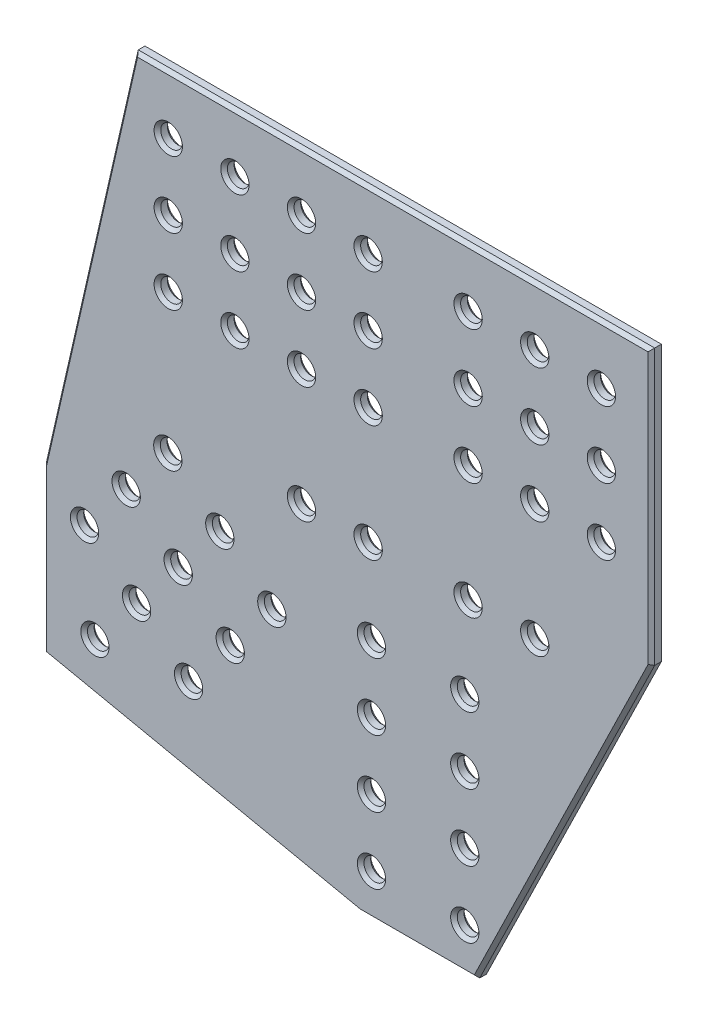
from build123d import *

# Parameters (mm, degrees)
SKETCH_1_R         = 13
EXTRUDE_1498_DEPTH = 16
CHAMFER_2_SIZE     = 4


with BuildPart() as part:
    # 草图1 → Extrude 1498 (new body)
    with BuildSketch(Plane.XY):
        Polygon((730, -330), (520, -760), (380, -760), (0, -680), (0, -482.786642105), (110, 0), (730, 0), align=None)
        with Locations((510, -70)):
            Circle(SKETCH_1_R, mode=Mode.SUBTRACT)
        with Locations((590, -70)):
            Circle(SKETCH_1_R, mode=Mode.SUBTRACT)
        with Locations((670, -70)):
            Circle(SKETCH_1_R, mode=Mode.SUBTRACT)
        with Locations((510, -150)):
            Circle(SKETCH_1_R, mode=Mode.SUBTRACT)
        with Locations((590, -150)):
            Circle(SKETCH_1_R, mode=Mode.SUBTRACT)
        with Locations((670, -150)):
            Circle(SKETCH_1_R, mode=Mode.SUBTRACT)
        with Locations((510, -230)):
            Circle(SKETCH_1_R, mode=Mode.SUBTRACT)
        with Locations((590, -230)):
            Circle(SKETCH_1_R, mode=Mode.SUBTRACT)
        with Locations((670, -230)):
            Circle(SKETCH_1_R, mode=Mode.SUBTRACT)
        with Locations(Location((230, -230, 0), (0, 0, 180))):
            Circle(SKETCH_1_R, mode=Mode.SUBTRACT)
        with Locations(Location((310, -230, 0), (0, 0, 180))):
            Circle(SKETCH_1_R, mode=Mode.SUBTRACT)
        with Locations(Location((390, -230, 0), (0, 0, 180))):
            Circle(SKETCH_1_R, mode=Mode.SUBTRACT)
        with Locations(Location((230, -150, 0), (0, 0, 180))):
            Circle(SKETCH_1_R, mode=Mode.SUBTRACT)
        with Locations(Location((310, -150, 0), (0, 0, 180))):
            Circle(SKETCH_1_R, mode=Mode.SUBTRACT)
        with Locations(Location((390, -150, 0), (0, 0, 180))):
            Circle(SKETCH_1_R, mode=Mode.SUBTRACT)
        with Locations(Location((230, -70, 0), (0, 0, 180))):
            Circle(SKETCH_1_R, mode=Mode.SUBTRACT)
        with Locations(Location((310, -70, 0), (0, 0, 180))):
            Circle(SKETCH_1_R, mode=Mode.SUBTRACT)
        with Locations(Location((390, -70, 0), (0, 0, 180))):
            Circle(SKETCH_1_R, mode=Mode.SUBTRACT)
        with Locations((150, -70)):
            Circle(SKETCH_1_R, mode=Mode.SUBTRACT)
        with Locations((150, -150)):
            Circle(SKETCH_1_R, mode=Mode.SUBTRACT)
        with Locations((150, -230)):
            Circle(SKETCH_1_R, mode=Mode.SUBTRACT)
        with Locations((590, -370)):
            Circle(SKETCH_1_R, mode=Mode.SUBTRACT)
        with Locations((510, -370)):
            Circle(SKETCH_1_R, mode=Mode.SUBTRACT)
        with Locations(Location((390, -370, 0), (0, 0, 180))):
            Circle(SKETCH_1_R, mode=Mode.SUBTRACT)
        with Locations(Location((310, -370, 0), (0, 0, 180))):
            Circle(SKETCH_1_R, mode=Mode.SUBTRACT)
        with Locations((506, -470)):
            Circle(SKETCH_1_R, mode=Mode.SUBTRACT)
        with Locations((506, -550)):
            Circle(SKETCH_1_R, mode=Mode.SUBTRACT)
        with Locations((506, -630)):
            Circle(SKETCH_1_R, mode=Mode.SUBTRACT)
        with Locations((506, -710)):
            Circle(SKETCH_1_R, mode=Mode.SUBTRACT)
        with Locations(Location((394, -710, 0), (0, 0, 180))):
            Circle(SKETCH_1_R, mode=Mode.SUBTRACT)
        with Locations(Location((394, -630, 0), (0, 0, 180))):
            Circle(SKETCH_1_R, mode=Mode.SUBTRACT)
        with Locations(Location((394, -550, 0), (0, 0, 180))):
            Circle(SKETCH_1_R, mode=Mode.SUBTRACT)
        with Locations(Location((394, -470, 0), (0, 0, 180))):
            Circle(SKETCH_1_R, mode=Mode.SUBTRACT)
        with Locations((149.479377198, -397.484050539)):
            Circle(SKETCH_1_R, mode=Mode.SUBTRACT)
        with Locations((99.493096694, -459.945012437)):
            Circle(SKETCH_1_R, mode=Mode.SUBTRACT)
        with Locations((49.506816189, -522.405974336)):
            Circle(SKETCH_1_R, mode=Mode.SUBTRACT)
        with Locations((61.981497584, -634.85321674)):
            Circle(SKETCH_1_R, mode=Mode.SUBTRACT)
        with Locations((111.967778088, -572.392254841)):
            Circle(SKETCH_1_R, mode=Mode.SUBTRACT)
        with Locations((161.954058593, -509.931292942)):
            Circle(SKETCH_1_R, mode=Mode.SUBTRACT)
        with Locations((211.940339097, -447.470331043)):
            Circle(SKETCH_1_R, mode=Mode.SUBTRACT)
        with Locations(Location((174.428739987, -622.378535345, 0), (0, 0, 180))):
            Circle(SKETCH_1_R, mode=Mode.SUBTRACT)
        with Locations(Location((224.415020492, -559.917573446, 0), (0, 0, 180))):
            Circle(SKETCH_1_R, mode=Mode.SUBTRACT)
        with Locations(Location((274.401300996, -497.456611548, 0), (0, 0, 180))):
            Circle(SKETCH_1_R, mode=Mode.SUBTRACT)
    extrude(amount=EXTRUDE_1498_DEPTH)

    # 倒角2
    chamfer_2_edges = [part.edges().sort_by_distance(p)[0] for p in [
        (55, -241.393321053, 16),
        (497, -370, 0),
        (497, -370, 16),
        (403, -370, 0),
        (403, -370, 16),
        (323, -370, 0),
        (323, -370, 16),
        (493, -470, 0),
        (493, -470, 16),
        (493, -550, 0),
        (493, -550, 16),
        (493, -630, 0),
        (493, -630, 16),
        (493, -710, 0),
        (493, -710, 16),
        (407, -710, 0),
        (407, -710, 16),
        (0, -581.393321053, 16),
        (407, -630, 0),
        (407, -630, 16),
        (407, -550, 0),
        (407, -550, 16),
        (136.479377198, -397.484050539, 0),
        (136.479377198, -397.484050539, 16),
        (86.493096694, -459.945012437, 0),
        (86.493096694, -459.945012437, 16),
        (36.506816189, -522.405974336, 0),
        (36.506816189, -522.405974336, 16),
        (48.981497584, -634.85321674, 0),
        (48.981497584, -634.85321674, 16),
        (98.967778088, -572.392254841, 0),
        (98.967778088, -572.392254841, 16),
        (148.954058593, -509.931292942, 0),
        (148.954058593, -509.931292942, 16),
        (190, -720, 16),
        (198.940339097, -447.470331043, 0),
        (198.940339097, -447.470331043, 16),
        (187.428739987, -622.378535345, 0),
        (187.428739987, -622.378535345, 16),
        (237.415020492, -559.917573446, 0),
        (237.415020492, -559.917573446, 16),
        (287.401300996, -497.456611548, 0),
        (287.401300996, -497.456611548, 16),
        (407, -470, 0),
        (407, -470, 16),
        (497, -70, 0),
        (497, -70, 16),
        (450, -760, 16),
        (625, -545, 16),
        (577, -70, 0),
        (577, -70, 16),
        (657, -70, 0),
        (657, -70, 16),
        (497, -150, 0),
        (497, -150, 16),
        (577, -150, 0),
        (577, -150, 16),
        (657, -150, 0),
        (657, -150, 16),
        (730, -165, 16),
        (497, -230, 0),
        (497, -230, 16),
        (577, -230, 0),
        (577, -230, 16),
        (657, -230, 0),
        (657, -230, 16),
        (243, -230, 0),
        (243, -230, 16),
        (323, -230, 0),
        (323, -230, 16),
        (403, -230, 0),
        (403, -230, 16),
        (243, -150, 0),
        (243, -150, 16),
        (323, -150, 0),
        (323, -150, 16),
        (625, -545, 0),
        (420, 0, 16),
        (403, -150, 0),
        (403, -150, 16),
        (450, -760, 0),
        (243, -70, 0),
        (243, -70, 16),
        (190, -720, 0),
        (323, -70, 0),
        (323, -70, 16),
        (0, -581.393321053, 0),
        (403, -70, 0),
        (403, -70, 16),
        (55, -241.393321053, 0),
        (137, -70, 0),
        (137, -70, 16),
        (420, 0, 0),
        (137, -150, 0),
        (137, -150, 16),
        (730, -165, 0),
        (137, -230, 0),
        (137, -230, 16),
        (577, -370, 0),
        (577, -370, 16),
    ]]
    chamfer(chamfer_2_edges, length=CHAMFER_2_SIZE)


solid = part.part
